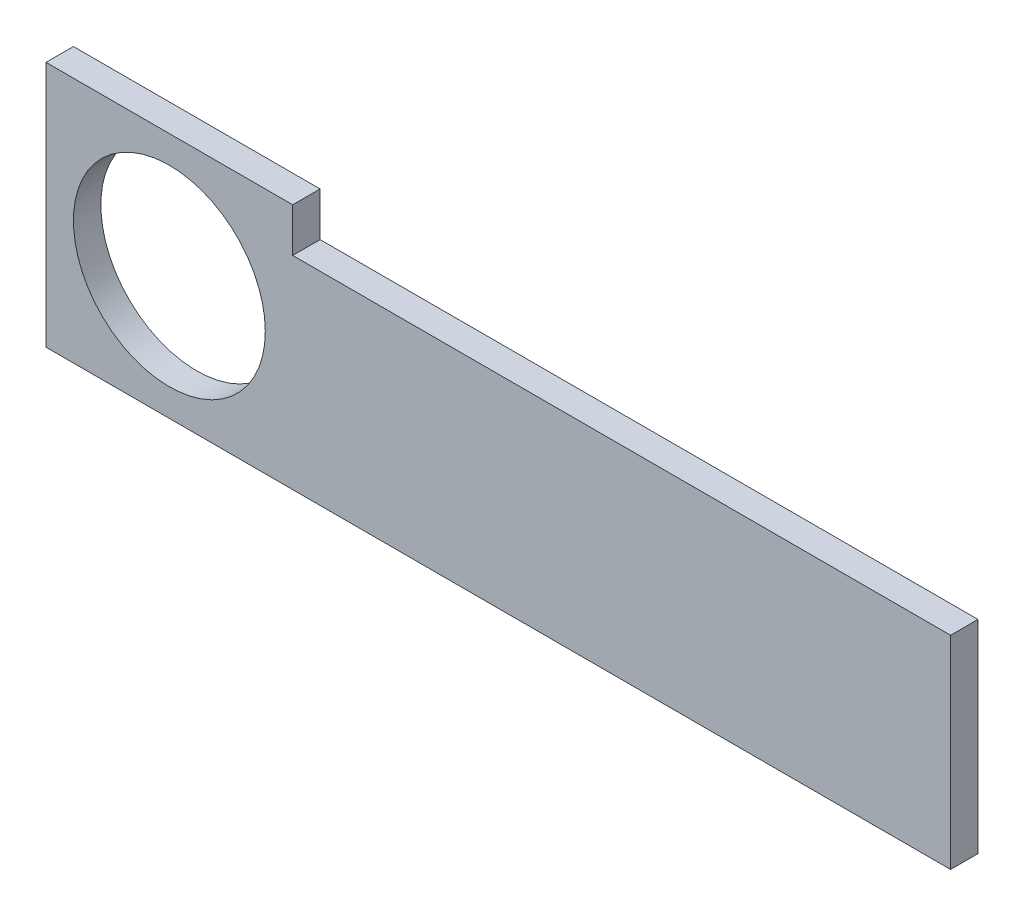
from build123d import *

# Parameters (mm, degrees)
BOSS_EXTRUDE1_DEPTH = 10
SKETCH2_R           = 35
CUT_EXTRUDE1_DEPTH  = 445.786169783


with BuildPart() as part:
    # Sketch1 → Boss-Extrude1 (new body)
    with BuildSketch(Plane.XY):
        Polygon((-100.300605602, 96.143326369), (-340.300605602, 96.143326369), (-340.300605602, 112.143326369), (-430.300605602, 112.143326369), (-430.300605602, 96.143326369), (-430.300605602, 22.143326369), (-100.300605602, 22.143326369), align=None)
    extrude(amount=BOSS_EXTRUDE1_DEPTH)

    # Sketch2 → Cut-Extrude1 (cut, through all)
    with BuildSketch(Plane.XY.offset(10)):
        with Locations((-385.300605602, 67.143326369)):
            Circle(SKETCH2_R)
    extrude(amount=-CUT_EXTRUDE1_DEPTH, mode=Mode.SUBTRACT)


solid = part.part
